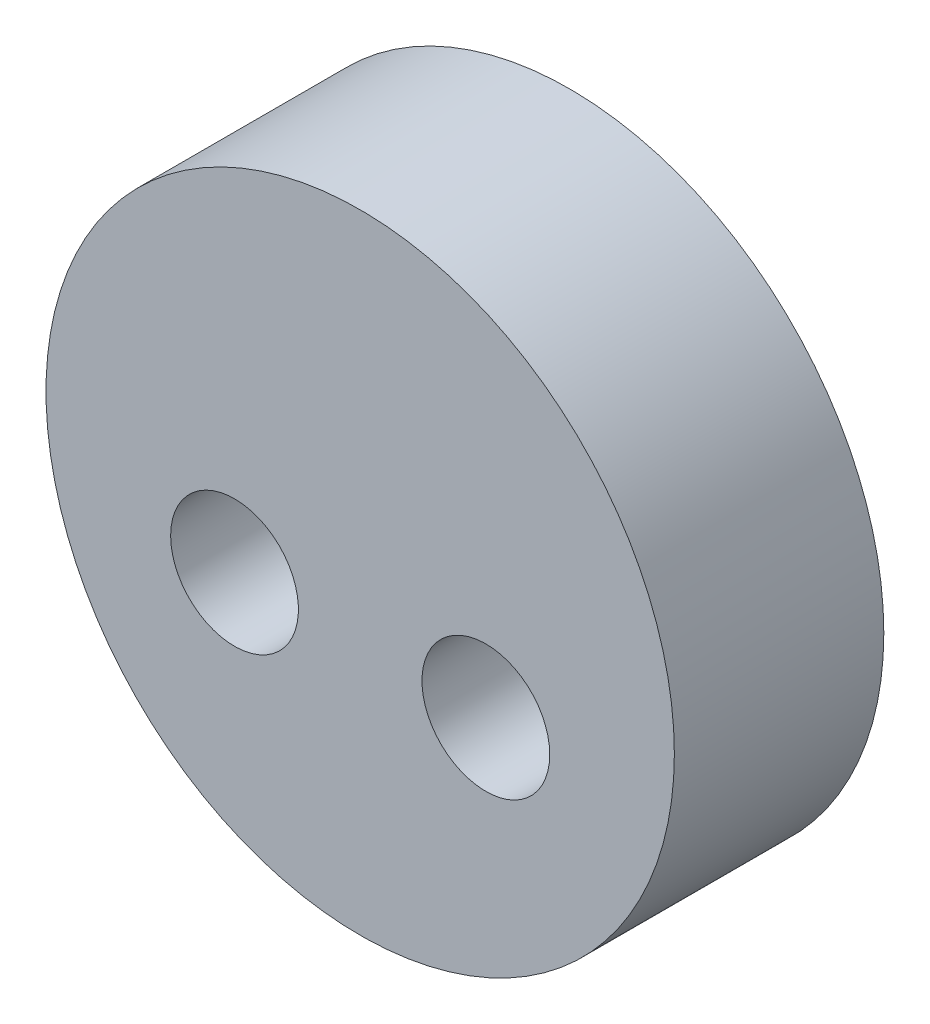
from build123d import *

# Parameters (mm, degrees)
SKETCH1_R           = 7.5
BOSS_EXTRUDE1_DEPTH = 5
SKETCH2_R           = 1.525
CUT_EXTRUDE1_DEPTH  = 12.7260394


with BuildPart() as part:
    # Sketch1 → Boss-Extrude1 (new body)
    with BuildSketch(Plane.XY):
        Circle(SKETCH1_R)
    extrude(amount=BOSS_EXTRUDE1_DEPTH)

    # Sketch2 → Cut-Extrude1 (cut, through all)
    with BuildSketch(Plane.XY.offset(5)):
        with Locations((3, -1.5)):
            Circle(SKETCH2_R)
        with Locations(Location((-3, -1.5, 0), (0, 0, 180))):
            Circle(SKETCH2_R)
    extrude(amount=-CUT_EXTRUDE1_DEPTH, mode=Mode.SUBTRACT)


solid = part.part
